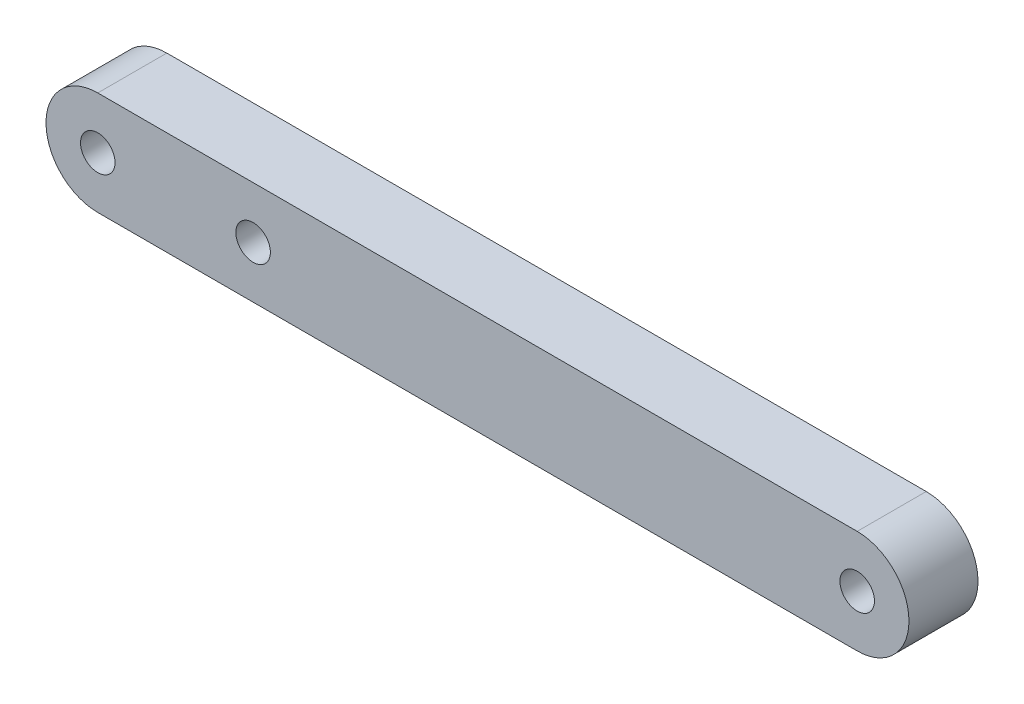
from build123d import *

# Parameters (mm, degrees)
SKETCH1_R           = 2.5
BOSS_EXTRUDE1_DEPTH = 10


with BuildPart() as part:
    # Sketch1 → Boss-Extrude1 (new body)
    with BuildSketch(Plane.XY):
        with BuildLine():
            Line((0, -7.5), (110, -7.5))
            ThreePointArc((110, -7.5), (117.5, 0), (110, 7.5))
            Line((110, 7.5), (0, 7.5))
            ThreePointArc((0, 7.5), (-7.5, 0), (0, -7.5))
        make_face()
        Circle(SKETCH1_R, mode=Mode.SUBTRACT)
        with Locations((22.5, 0)):
            Circle(SKETCH1_R, mode=Mode.SUBTRACT)
        with Locations((110, 0)):
            Circle(SKETCH1_R, mode=Mode.SUBTRACT)
    extrude(amount=BOSS_EXTRUDE1_DEPTH)


solid = part.part
